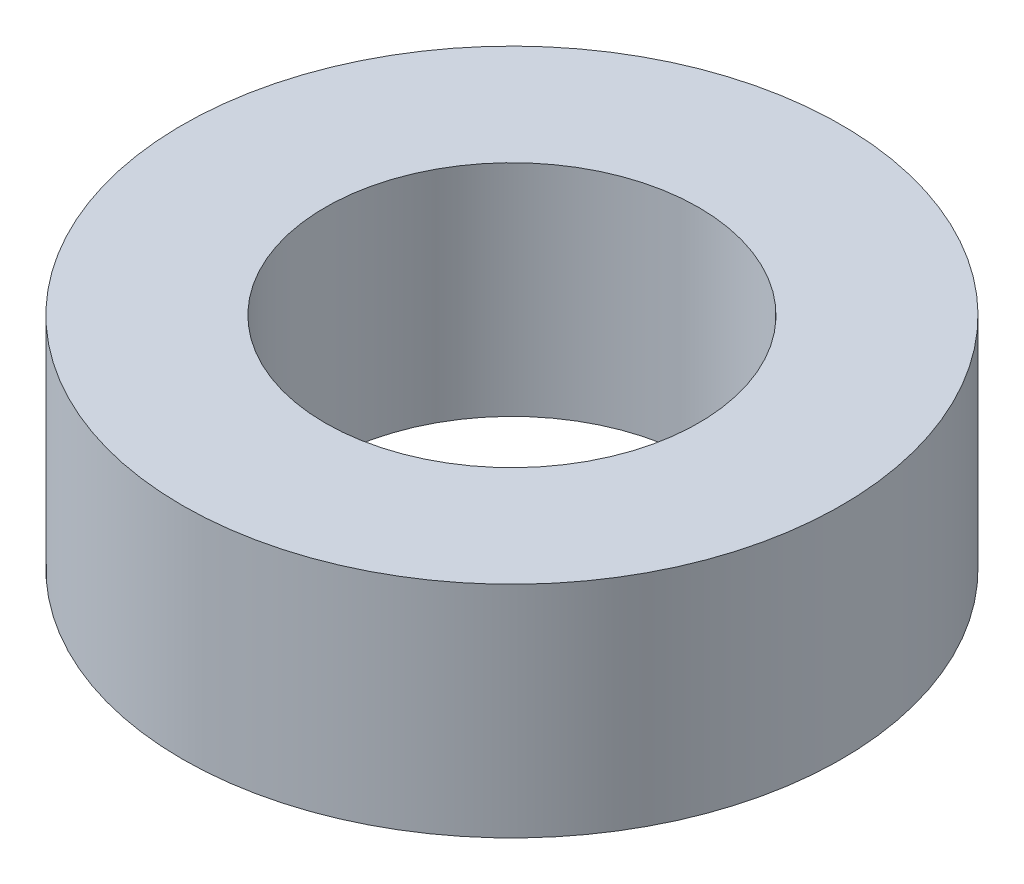
from build123d import *

# Parameters (mm, degrees)
SKETCH_1_R      = 3
SKETCH_1_R_2    = 1.7
EXTRUDE_1_DEPTH = 2


with BuildPart() as part:
    # 草图1 → 凸台-拉伸1 (new body)
    with BuildSketch(Plane(origin=(0, 0, 0), x_dir=(1, 0, 0), z_dir=(0, 1, 0))):
        with Locations(Location((0, 0, 0), (0, 0, 270))):
            Circle(SKETCH_1_R)
        with Locations(Location((0, 0, 0), (0, 0, 270))):
            Circle(SKETCH_1_R_2, mode=Mode.SUBTRACT)
    extrude(amount=EXTRUDE_1_DEPTH)


solid = part.part
